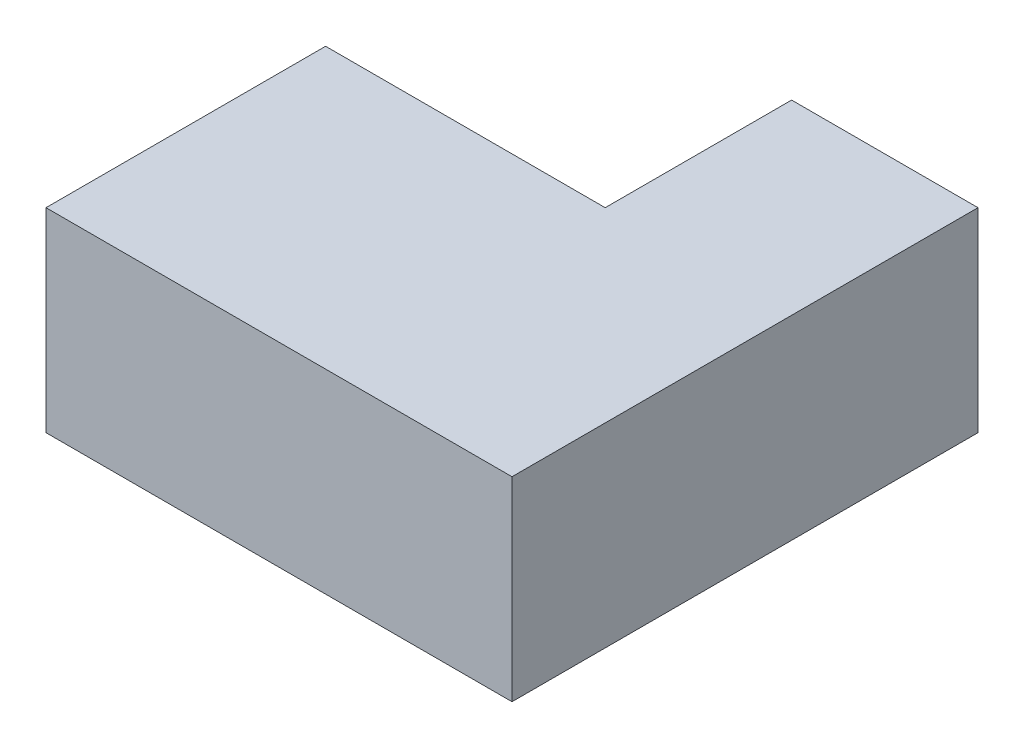
from build123d import *

# Parameters (mm, degrees)
BOSS_EXTRUDE1_DEPTH = 265.557


with BuildPart() as part:
    # Sketch2 → Boss-Extrude1 (new, symmetric)
    with BuildSketch(Plane(origin=(0, 0, 0), x_dir=(1, 0, 0), z_dir=(0, 1, 0))):
        Polygon((0, 0), (1270, 0), (1270, 1270), (762, 1270), (762, 762), (0, 762), align=None)
    extrude(amount=BOSS_EXTRUDE1_DEPTH, both=True)


solid = part.part
